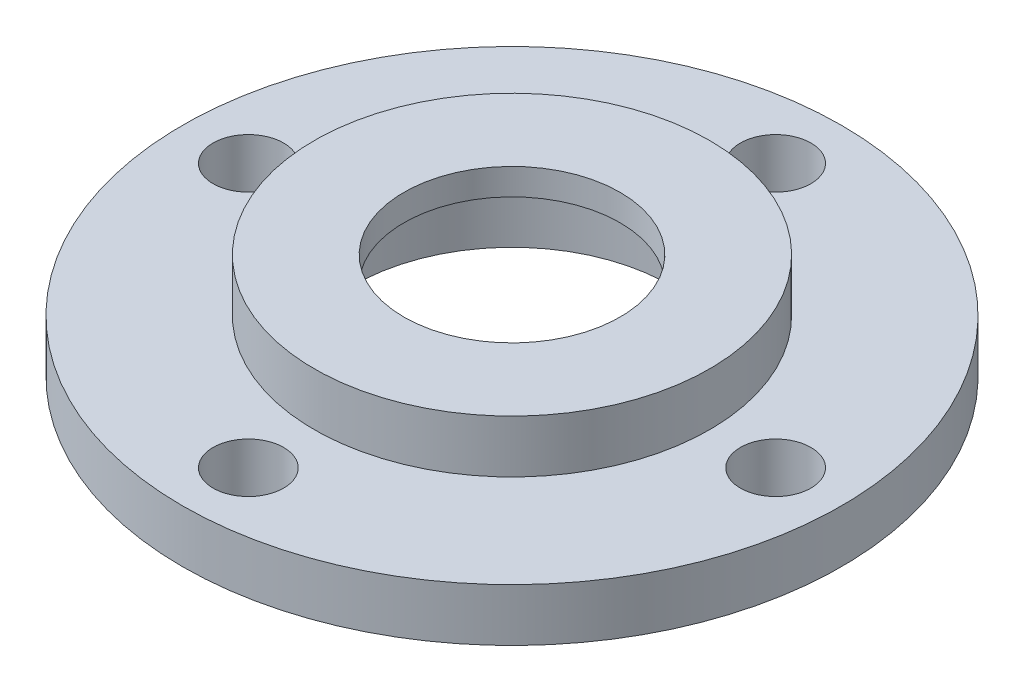
from build123d import *

# Parameters (mm, degrees)
SKETCH1_R           = 15.875
BOSS_EXTRUDE1_DEPTH = 2.54
SKETCH2_R           = 9.525
BOSS_EXTRUDE2_DEPTH = 2.54
SKETCH3_R           = 7.62
CUT_EXTRUDE1_DEPTH  = 3.81
CUT_EXTRUDE2_REACH  = 25.018
SKETCH4_R           = 5.207
CUT_EXTRUDE3_REACH  = 24.594
SKETCH5_R           = 1.7


with BuildPart() as part:
    # Sketch1 → Boss-Extrude1 (new body)
    with BuildSketch(Plane(origin=(0, 0, 0), x_dir=(1, 0, 0), z_dir=(0, 1, 0))):
        with Locations(Location((0, 0, 0), (0, 0, 270))):
            Circle(SKETCH1_R)
    extrude(amount=BOSS_EXTRUDE1_DEPTH)

    # Sketch2 → Boss-Extrude2 (add)
    with BuildSketch(Plane(origin=(0, 2.54, 0), x_dir=(1, 0, 0), z_dir=(0, 1, 0))):
        with Locations(Location((0, 0, 0), (0, 0, 270))):
            Circle(SKETCH2_R)
    extrude(amount=BOSS_EXTRUDE2_DEPTH)

    # Sketch3 → Cut-Extrude1 (cut)
    with BuildSketch(Plane.XZ):
        with Locations(Location((0, 0, 0), (0, 0, 270))):
            Circle(SKETCH3_R)
    extrude(amount=-CUT_EXTRUDE1_DEPTH, mode=Mode.SUBTRACT)

    # Sketch4 → Cut-Extrude2 (cut, up to next)
    with BuildSketch(Plane(origin=(0, 5.08, 0), x_dir=(1, 0, 0), z_dir=(0, 1, 0)), mode=Mode.PRIVATE) as cut_extrude2_sk1:
        with Locations(Location((0, 0, 0), (0, 0, 270))):
            Circle(SKETCH4_R)
    cut_extrude2_tool1 = extrude(cut_extrude2_sk1.sketch, amount=-CUT_EXTRUDE2_REACH, mode=Mode.PRIVATE) & part.part
    add(cut_extrude2_tool1.solids().sort_by_distance((0, 5.08, 0))[0], mode=Mode.SUBTRACT)

    # Sketch5 → Cut-Extrude3 (cut, up to next)
    with BuildSketch(Plane(origin=(0, 2.54, 0), x_dir=(1, 0, 0), z_dir=(0, 1, 0)), mode=Mode.PRIVATE) as cut_extrude3_sk1:
        with Locations(Location((0, 12.7, 0), (0, 0, 270))):
            Circle(SKETCH5_R)
    cut_extrude3_tool1 = extrude(cut_extrude3_sk1.sketch, amount=-CUT_EXTRUDE3_REACH, mode=Mode.PRIVATE) & part.part
    # Sketch5 → Cut-Extrude3 (cut, up to next)
    with BuildSketch(Plane(origin=(0, 2.54, 0), x_dir=(1, 0, 0), z_dir=(0, 1, 0)), mode=Mode.PRIVATE) as cut_extrude3_sk2:
        with Locations(Location((12.7, 0, 0), (0, 0, 270))):
            Circle(SKETCH5_R)
    cut_extrude3_tool2 = extrude(cut_extrude3_sk2.sketch, amount=-CUT_EXTRUDE3_REACH, mode=Mode.PRIVATE) & part.part
    # Sketch5 → Cut-Extrude3 (cut, up to next)
    with BuildSketch(Plane(origin=(0, 2.54, 0), x_dir=(1, 0, 0), z_dir=(0, 1, 0)), mode=Mode.PRIVATE) as cut_extrude3_sk3:
        with Locations(Location((0, -12.7, 0), (0, 0, 270))):
            Circle(SKETCH5_R)
    cut_extrude3_tool3 = extrude(cut_extrude3_sk3.sketch, amount=-CUT_EXTRUDE3_REACH, mode=Mode.PRIVATE) & part.part
    # Sketch5 → Cut-Extrude3 (cut, up to next)
    with BuildSketch(Plane(origin=(0, 2.54, 0), x_dir=(1, 0, 0), z_dir=(0, 1, 0)), mode=Mode.PRIVATE) as cut_extrude3_sk4:
        with Locations(Location((-12.7, 0, 0), (0, 0, 270))):
            Circle(SKETCH5_R)
    cut_extrude3_tool4 = extrude(cut_extrude3_sk4.sketch, amount=-CUT_EXTRUDE3_REACH, mode=Mode.PRIVATE) & part.part
    add(cut_extrude3_tool1.solids().sort_by_distance((0, 2.54, -12.7))[0], mode=Mode.SUBTRACT)
    add(cut_extrude3_tool2.solids().sort_by_distance((12.7, 2.54, 0))[0], mode=Mode.SUBTRACT)
    add(cut_extrude3_tool3.solids().sort_by_distance((0, 2.54, 12.7))[0], mode=Mode.SUBTRACT)
    add(cut_extrude3_tool4.solids().sort_by_distance((-12.7, 2.54, 0))[0], mode=Mode.SUBTRACT)


solid = part.part
